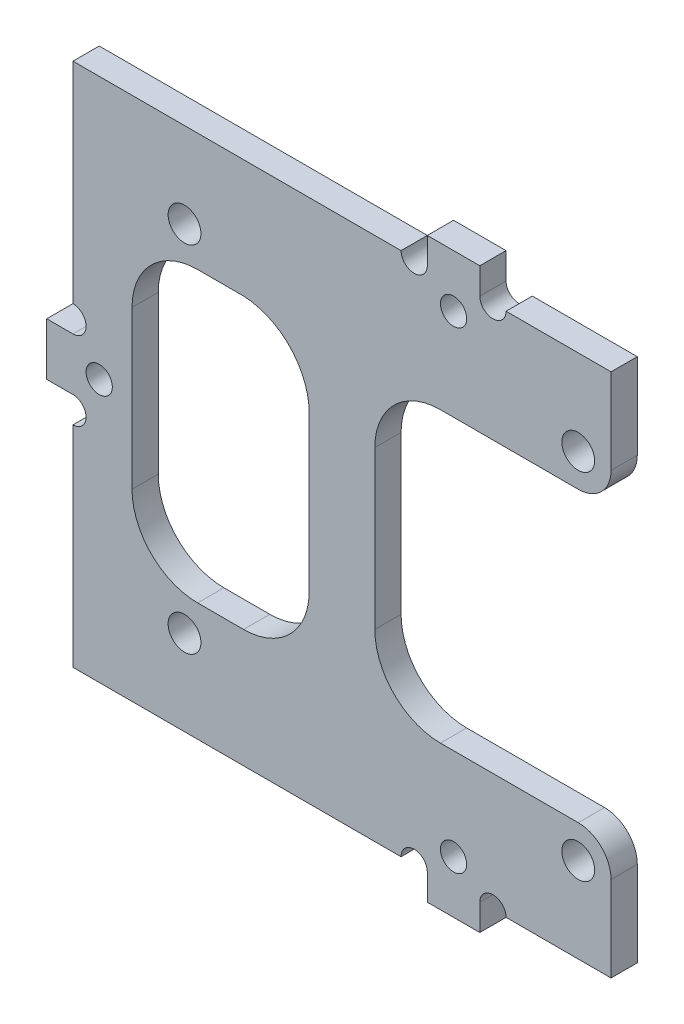
from build123d import *

# Parameters (mm, degrees)
SKETCH_1_R          = 1.25
SKETCH_1_R_2        = 1
EXTRUDE_1_DEPTH     = 2
SKETCH_4_W          = 18
SKETCH_4_H          = 22
CUT_EXTRUDE_1_DEPTH = 2
FILLET_2_R          = 2.5
FILLET_3_R          = 5
CUT_EXTRUDE_2_DEPTH = 2
SKETCH_7_R          = 1
CUT_EXTRUDE_3_DEPTH = 10
SKETCH_8_W          = 4
SKETCH_8_H          = 2
EXTRUDE_2_DEPTH     = 2
CUT_EXTRUDE_4_DEPTH = 2


with BuildPart() as part:
    # 草圖1 → 填料-伸長1 (new body)
    with BuildSketch(Plane.XY):
        Polygon((15.283786802, 18.1625), (-25.716213198, 18.1625), (-25.716213198, 0.1625), (-27.716213198, 0.1625), (-27.716213198, -3.8375), (-25.716213198, -3.8375), (-25.716213198, -21.8375), (15.283786802, -21.8375), align=None)
        with Locations((-17.216213198, 11.6625)):
            Circle(SKETCH_1_R, mode=Mode.SUBTRACT)
        with Locations((-17.216213198, -15.3375)):
            Circle(SKETCH_1_R, mode=Mode.SUBTRACT)
        with Locations((12.783786802, -15.3375)):
            Circle(SKETCH_1_R, mode=Mode.SUBTRACT)
        with Locations((12.783786802, 11.6625)):
            Circle(SKETCH_1_R, mode=Mode.SUBTRACT)
        with Locations((-23.716213198, -1.8375)):
            Circle(SKETCH_1_R_2, mode=Mode.SUBTRACT)
    extrude(amount=EXTRUDE_1_DEPTH)

    # 草圖4 → 除料-伸長1 (cut)
    with BuildSketch(Plane(origin=(0, 0, 0), x_dir=(-1, 0, 0), z_dir=(0, 0, -1))):
        with Locations((-6.283786802, -1.8375)):
            Rectangle(SKETCH_4_W, SKETCH_4_H)
    extrude(amount=-CUT_EXTRUDE_1_DEPTH, mode=Mode.SUBTRACT)

    # 圓角2
    fillet_2_edges = [part.edges().sort_by_distance(p)[0] for p in [
        (15.283786802, -12.8375, 1),
        (15.283786802, 9.1625, 1),
    ]]
    fillet(fillet_2_edges, radius=FILLET_2_R)

    # 圓角3
    fillet_3_edges = [part.edges().sort_by_distance(p)[0] for p in [
        (-2.716213198, 9.1625, 1),
        (-2.716213198, -12.8375, 1),
    ]]
    fillet(fillet_3_edges, radius=FILLET_3_R)

    # 草圖5 → 除料-伸長2 (cut)
    with BuildSketch(Plane(origin=(0, 0, 0), x_dir=(-1, 0, 0), z_dir=(0, 0, -1))):
        with BuildLine():
            Line((7.716213198, 3.948031945), (7.716213198, -7.8375))
            ThreePointArc((7.716213198, -7.8375), (9.180679292, -11.373033906), (12.716213198, -12.8375))
            Line((12.716213198, -12.8375), (16.216213198, -12.8375))
            ThreePointArc((16.216213198, -12.8375), (19.751747104, -11.373033906), (21.216213198, -7.8375))
            Line((21.216213198, -7.8375), (21.216213198, 4.1625))
            ThreePointArc((21.216213198, 4.1625), (19.751747104, 7.698033906), (16.216213198, 9.1625))
            Line((16.216213198, 9.1625), (12.716213198, 9.1625))
            ThreePointArc((12.716213198, 9.1625), (9.168164983, 7.56020857), (7.716213198, 3.948031945))
        make_face()
    extrude(amount=-CUT_EXTRUDE_2_DEPTH, mode=Mode.SUBTRACT)

    # 草圖7 → 除料-伸長3 (cut)
    with BuildSketch(Plane(origin=(0, 0, 0), x_dir=(-1, 0, 0), z_dir=(0, 0, -1))):
        with Locations((-3.283786802, -19.8375)):
            Circle(SKETCH_7_R)
        with Locations((-3.283786802, 16.1625)):
            Circle(SKETCH_7_R)
    extrude(amount=-CUT_EXTRUDE_3_DEPTH, mode=Mode.SUBTRACT)

    # 草圖8 → 填料-伸長2 (add)
    with BuildSketch(Plane(origin=(0, 0, 0), x_dir=(-1, 0, 0), z_dir=(0, 0, -1))):
        with Locations((-3.283786802, 19.1625)):
            Rectangle(SKETCH_8_W, SKETCH_8_H)
        with Locations((-3.283786802, -22.8375)):
            Rectangle(SKETCH_8_W, SKETCH_8_H)
    extrude(amount=-EXTRUDE_2_DEPTH)

    # 草圖9 → 除料-伸長4 (cut)
    with BuildSketch(Plane(origin=(0, 0, 0), x_dir=(-1, 0, 0), z_dir=(0, 0, -1))):
        with BuildLine():
            Line((-7.283786802, 18.1625), (-5.283786802, 18.1625))
            ThreePointArc((-5.283786802, 18.1625), (-6.283786802, 17.1625), (-7.283786802, 18.1625))
        make_face()
        with BuildLine():
            Line((-1.283786802, 18.1625), (0.716213198, 18.1625))
            ThreePointArc((0.716213198, 18.1625), (-0.283786802, 17.1625), (-1.283786802, 18.1625))
        make_face()
        with BuildLine():
            Line((-7.283786802, -21.8375), (-5.283786802, -21.8375))
            ThreePointArc((-5.283786802, -21.8375), (-6.283786802, -20.8375), (-7.283786802, -21.8375))
        make_face()
        with BuildLine():
            Line((-1.283786802, -21.8375), (0.716213198, -21.8375))
            ThreePointArc((0.716213198, -21.8375), (-0.283786802, -20.8375), (-1.283786802, -21.8375))
        make_face()
        with BuildLine():
            Line((25.716213198, 2.1625), (25.716213198, 0.1625))
            ThreePointArc((25.716213198, 0.1625), (24.716213198, 1.1625), (25.716213198, 2.1625))
        make_face()
        with BuildLine():
            Line((25.716213198, -3.8375), (25.716213198, -5.8375))
            ThreePointArc((25.716213198, -5.8375), (24.716213198, -4.8375), (25.716213198, -3.8375))
        make_face()
    extrude(amount=-CUT_EXTRUDE_4_DEPTH, mode=Mode.SUBTRACT)


solid = part.part
